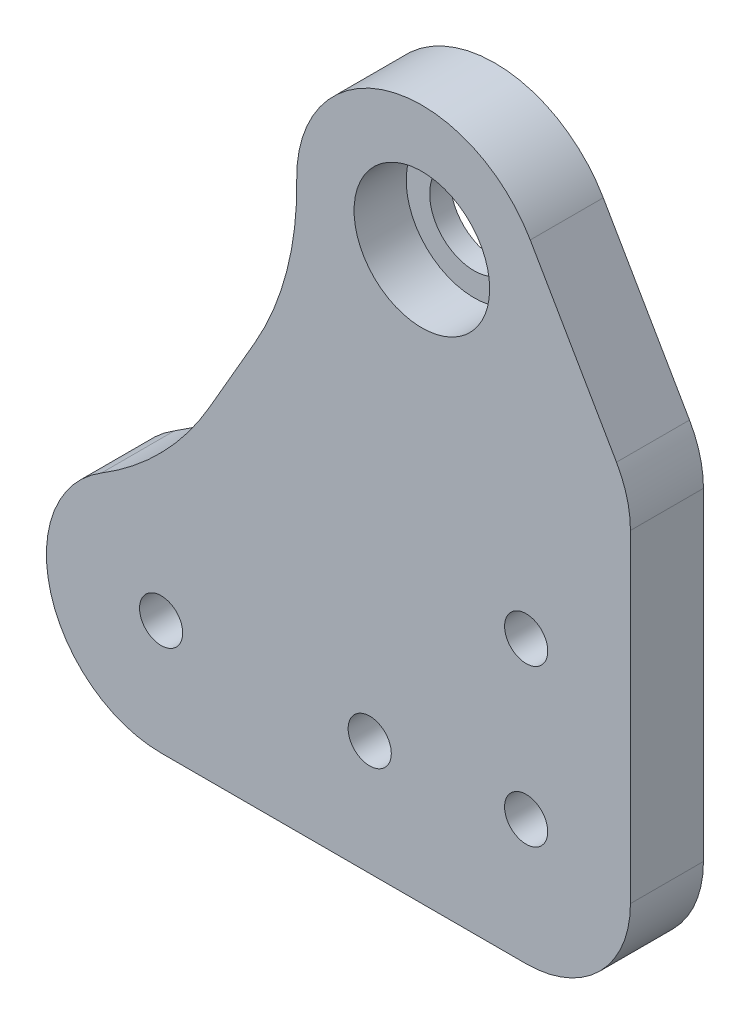
from build123d import *

# Parameters (mm, degrees)
SKETCH_1_R          = 2.07
SKETCH_1_R_2        = 4.25
EXTRUDE_1_DEPTH     = 7
SKETCH_2_R          = 6.5
CUT_EXTRUDE_1_DEPTH = 5
SKETCH_3_R          = 2.07
CUT_EXTRUDE_2_DEPTH = 72.639587412


with BuildPart() as part:
    # 草图1 → 凸台-拉伸1 (new body)
    with BuildSketch(Plane.XY):
        with BuildLine():
            ThreePointArc((13.001837611, 43.091271905), (12.051039078, 35.055565267), (8.987193751, 27.566276194))
            Line((8.987193751, 27.566276194), (4.614556012, 19.992645468))
            ThreePointArc((4.614556012, 19.992645468), (0.106016193, 14.041662919), (-5.732396759, 9.388270735))
            ThreePointArc((-5.732396759, 9.388270735), (-10.589404565, -2.977332859), (0, -11))
            Line((0, -11), (35, -11))
            ThreePointArc((35, -11), (42.071067812, -8.071067812), (45, -1))
            Line((45, -1), (45, 29.980762114))
            ThreePointArc((45, 29.980762114), (44.659258263, 32.568952565), (43.660254038, 34.980762114))
            Line((43.660254038, 34.980762114), (35.392304845, 49.301270189))
            ThreePointArc((35.392304845, 49.301270189), (31, 53.693575035), (25, 55.301270189))
            ThreePointArc((25, 55.301270189), (16.440795031, 51.711978263), (13.001837611, 43.091271905))
        make_face()
        Circle(SKETCH_1_R, mode=Mode.SUBTRACT)
        with Locations((35, 1)):
            Circle(SKETCH_1_R, mode=Mode.SUBTRACT)
        with Locations((35, 16)):
            Circle(SKETCH_1_R, mode=Mode.SUBTRACT)
        with Locations((25, 43.301270189)):
            Circle(SKETCH_1_R_2, mode=Mode.SUBTRACT)
    extrude(amount=EXTRUDE_1_DEPTH)

    # 草图2 → 切除-拉伸1 (cut)
    with BuildSketch(Plane.XY.offset(7)):
        with Locations((25, 43.301270189)):
            Circle(SKETCH_2_R)
    extrude(amount=-CUT_EXTRUDE_1_DEPTH, mode=Mode.SUBTRACT)

    # 草图3 → 切除-拉伸2 (cut, through all)
    with BuildSketch(Plane.XY.offset(7)):
        with Locations((20, 0)):
            Circle(SKETCH_3_R)
    extrude(amount=-CUT_EXTRUDE_2_DEPTH, mode=Mode.SUBTRACT)


solid = part.part
